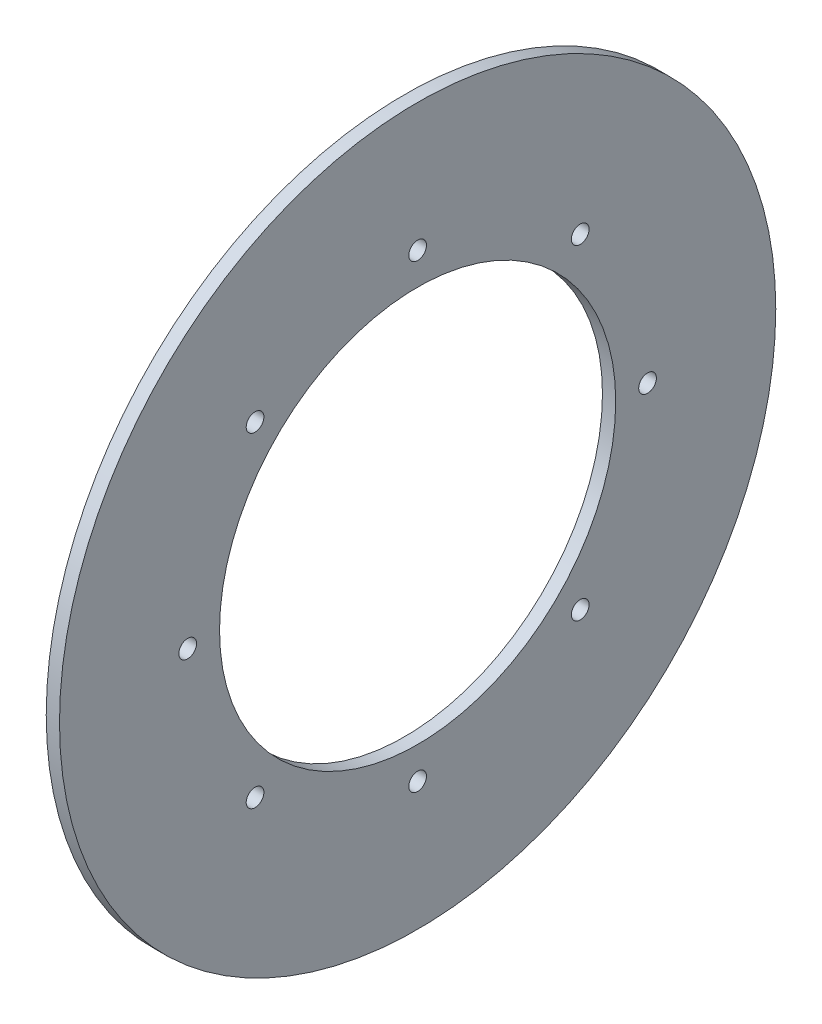
from build123d import *

# Parameters (mm, degrees)
SKETCH1_R           = 81
SKETCH1_R_2         = 44.800813008
BOSS_EXTRUDE1_DEPTH = 3
SKETCH2_R           = 2
CUT_EXTRUDE1_DEPTH  = 3
CIRPATTERN1_COUNT   = 8
SKETCH3_W           = 15.5
SKETCH3_H           = 10.25
BOSS_EXTRUDE2_DEPTH = 1
SKETCH4_W           = 12
SKETCH4_H           = 1
BOSS_EXTRUDE3_DEPTH = 9
SKETCH5_W           = 3.5
SKETCH5_H           = 2
BOSS_EXTRUDE4_DEPTH = 9
CIRPATTERN5_COUNT   = 3


with BuildPart() as part:
    # Sketch1 → Boss-Extrude1 (new body)
    with BuildSketch(Plane(origin=(0, 0, 0), x_dir=(0, 0, -1), z_dir=(1, 0, 0))):
        Circle(SKETCH1_R)
        Circle(SKETCH1_R_2, mode=Mode.SUBTRACT)
    extrude(amount=BOSS_EXTRUDE1_DEPTH)

    # Sketch2 → Cut-Extrude1 (cut)
    with BuildSketch(Plane(origin=(3, 0, 0), x_dir=(0, 0, -1), z_dir=(1, 0, 0))):
        with Locations((0, 52)):
            Circle(SKETCH2_R)
    cut_extrude1 = extrude(amount=-CUT_EXTRUDE1_DEPTH, mode=Mode.SUBTRACT)

    # CirPattern1: Cut-Extrude1 ×8 about axis
    cirpattern1_axis = Axis((0, 0, 0), (1, 0, 0))
    for i in range(1, CIRPATTERN1_COUNT):
        add(cut_extrude1.rotate(cirpattern1_axis, i * 360 / CIRPATTERN1_COUNT), mode=Mode.SUBTRACT)

    # Sketch3 → Boss-Extrude2 (add)
    with BuildSketch(Plane(origin=(0, 0, 0), x_dir=(0, 0, -1), z_dir=(1, 0, 0))):
        with Locations((-7.721207901, 64.539778033)):
            Rectangle(SKETCH3_W, SKETCH3_H)
    boss_extrude2 = extrude(amount=-BOSS_EXTRUDE2_DEPTH)

    # Sketch4 → Boss-Extrude3 (add)
    with BuildSketch(Plane(origin=(0, 0, 0), x_dir=(0, 0, -1), z_dir=(1, 0, 0))):
        with Locations((-5.971207901, 59.379009095)):
            Rectangle(SKETCH4_W, SKETCH4_H)
    boss_extrude3 = extrude(amount=-BOSS_EXTRUDE3_DEPTH)

    # Sketch5 → Boss-Extrude4 (add)
    with BuildSketch(Plane(origin=(0, 59.879009095, 0), x_dir=(1, 0, 0), z_dir=(0, 1, 0))):
        with Locations((-6.25, -3.398209268)):
            Rectangle(SKETCH5_W, SKETCH5_H)
    boss_extrude4 = extrude(amount=BOSS_EXTRUDE4_DEPTH)

    # CirPattern5: Boss-Extrude2, Boss-Extrude3, Boss-Extrude4 ×3 about axis
    cirpattern5_axis = Axis((0, 0, 0), (1, 0, 0))
    add([boss_extrude2.rotate(cirpattern5_axis, i * 360 / CIRPATTERN5_COUNT) for i in range(1, CIRPATTERN5_COUNT)])
    add([boss_extrude3.rotate(cirpattern5_axis, i * 360 / CIRPATTERN5_COUNT) for i in range(1, CIRPATTERN5_COUNT)])
    add([boss_extrude4.rotate(cirpattern5_axis, i * 360 / CIRPATTERN5_COUNT) for i in range(1, CIRPATTERN5_COUNT)])


solid = part.part
